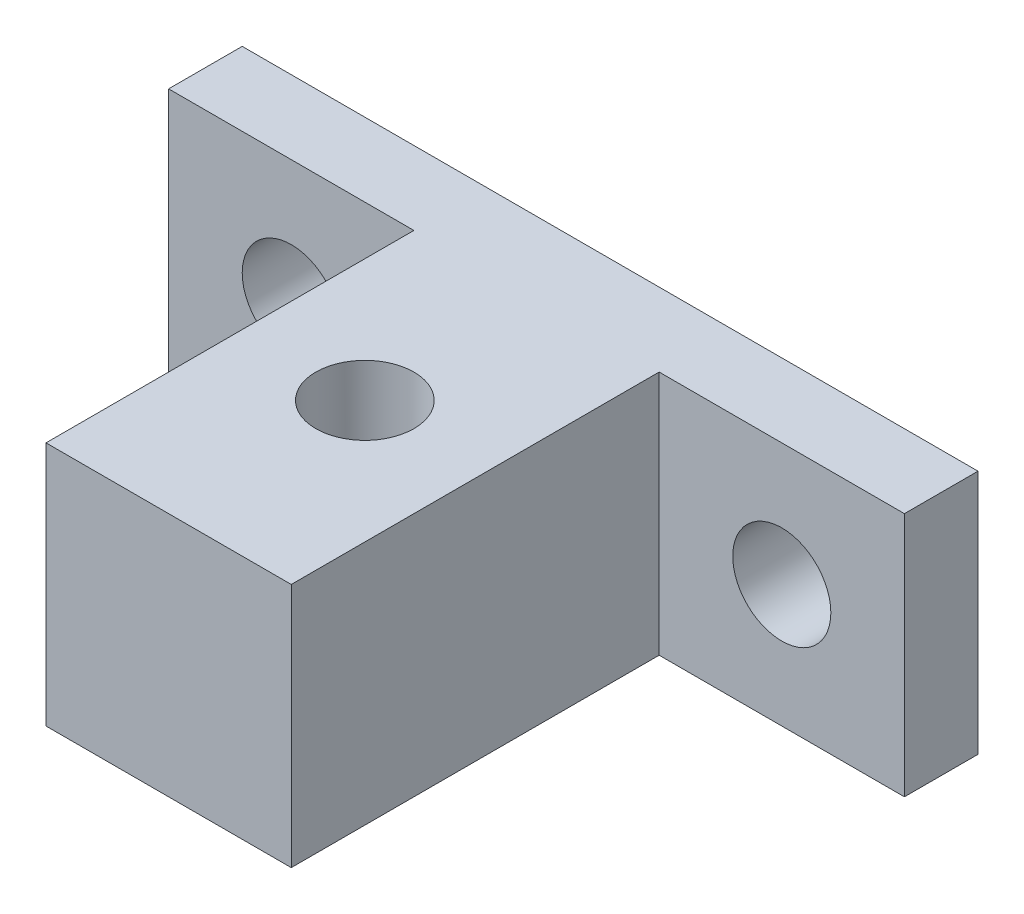
from build123d import *

# Parameters (mm, degrees)
SKETCH1_W               = 30
SKETCH1_H               = 10
SKETCH1_R               = 2
BOSS_EXTRUDE1_DEPTH     = 3
SKETCH2_W               = 10
SKETCH2_H               = 10
BOSS_EXTRUDE2_DEPTH     = 15
CUT_EXTRUDE1_START      = -10
SKETCH3_R               = 2
CUT_EXTRUDE1_DEPTH      = 5
CUT_EXTRUDE2_DEPTH      = 33.388269481
CUT_EXTRUDE2_DEPTH_BACK = 33.388269481
SKETCH3_2_R             = 2


with BuildPart() as part:
    # Sketch1 → Boss-Extrude1 (new body)
    with BuildSketch(Plane.XY):
        with Locations((10, -8.3)):
            Rectangle(SKETCH1_W, SKETCH1_H)
        with Locations((20, -8.3)):
            Circle(SKETCH1_R, mode=Mode.SUBTRACT)
        with Locations(Location((0, -8.3, 0), (0, 0, 180))):
            Circle(SKETCH1_R, mode=Mode.SUBTRACT)
    extrude(amount=BOSS_EXTRUDE1_DEPTH)

    # Sketch2 → Boss-Extrude2 (add)
    with BuildSketch(Plane.XY.offset(3)):
        with Locations((10, -8.3)):
            Rectangle(SKETCH2_W, SKETCH2_H)
    extrude(amount=BOSS_EXTRUDE2_DEPTH)

    # Sketch3 → Cut-Extrude1 (cut)
    with BuildSketch(Plane(origin=(0, -3.3, 0), x_dir=(1, 0, 0), z_dir=(0, 1, 0)).offset(CUT_EXTRUDE1_START)):
        Polygon((10, -6.07401817), (6.6, -8.037009085), (6.6, -11.962990915), (10, -13.92598183), (13.4, -11.962990915), (13.4, -8.037009085), align=None)
        with Locations(Location((10, -10, 0), (0, 0, 270))):
            Circle(SKETCH3_R, mode=Mode.SUBTRACT)
    extrude(amount=CUT_EXTRUDE1_DEPTH, mode=Mode.SUBTRACT)

    # Sketch3<2> → Cut-Extrude2 (cut, two sides: drawn at the far end of the back side and taken through both)
    with BuildSketch(Plane(origin=(0, -3.3, 0), x_dir=(1, 0, 0), z_dir=(0, 1, 0)).offset(-CUT_EXTRUDE2_DEPTH_BACK)):
        with Locations(Location((10, -10, 0), (0, 0, 270))):
            Circle(SKETCH3_2_R)
    extrude(amount=CUT_EXTRUDE2_DEPTH + CUT_EXTRUDE2_DEPTH_BACK, mode=Mode.SUBTRACT)


solid = part.part
